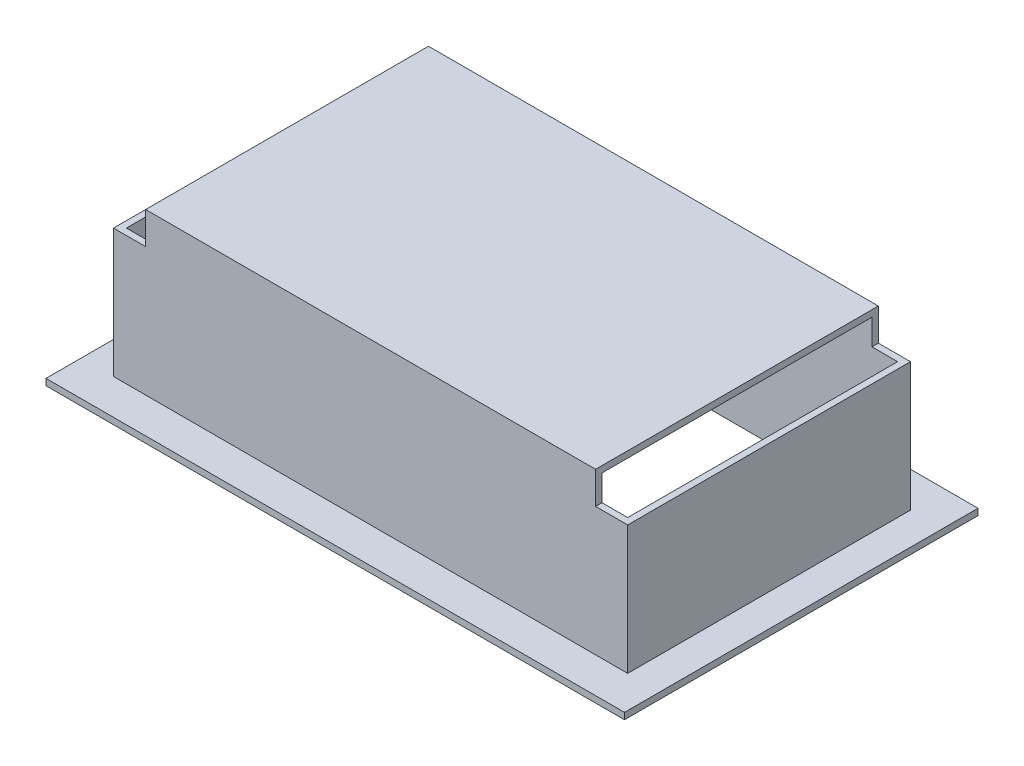
from build123d import *

# Parameters (mm, degrees)
SKETCH_1_W          = 78
SKETCH_1_H          = 42
EXTRUDE_1_DEPTH     = 25
SHELL_1_T           = 1
SKETCH_2_W          = 90
SKETCH_2_H          = 55
SKETCH_2_W_2        = 80
SKETCH_2_H_2        = 44
EXTRUDE_2_DEPTH     = 1
SKETCH_3_W          = 5
SKETCH_3_H          = 44
CUT_EXTRUDE_1_DEPTH = 5


with BuildPart() as part:
    # 草图1 → 凸台-拉伸1 (new body)
    with BuildSketch(Plane(origin=(0, 0, 0), x_dir=(1, 0, 0), z_dir=(0, 1, 0))):
        Rectangle(SKETCH_1_W, SKETCH_1_H)
    extrude(amount=EXTRUDE_1_DEPTH)

    # 抽壳1
    shell_1_openings = [part.faces().sort_by_distance(p)[0] for p in [
        (0, 0, 0),
    ]]
    offset(amount=SHELL_1_T, openings=shell_1_openings, kind=Kind.INTERSECTION)

    # 草图2 → 凸台-拉伸2 (add)
    with BuildSketch(Plane.XZ):
        Rectangle(SKETCH_2_W, SKETCH_2_H)
        Rectangle(SKETCH_2_W_2, SKETCH_2_H_2, mode=Mode.SUBTRACT)
    extrude(amount=-EXTRUDE_2_DEPTH)

    # 草图3 → 切除-拉伸1 (cut)
    with BuildSketch(Plane(origin=(0, 26, 0), x_dir=(1, 0, 0), z_dir=(0, 1, 0))):
        with Locations((-37.5, 0)):
            Rectangle(SKETCH_3_W, SKETCH_3_H)
        with Locations((37.5, 0)):
            Rectangle(SKETCH_3_W, SKETCH_3_H)
    extrude(amount=-CUT_EXTRUDE_1_DEPTH, mode=Mode.SUBTRACT)


solid = part.part
